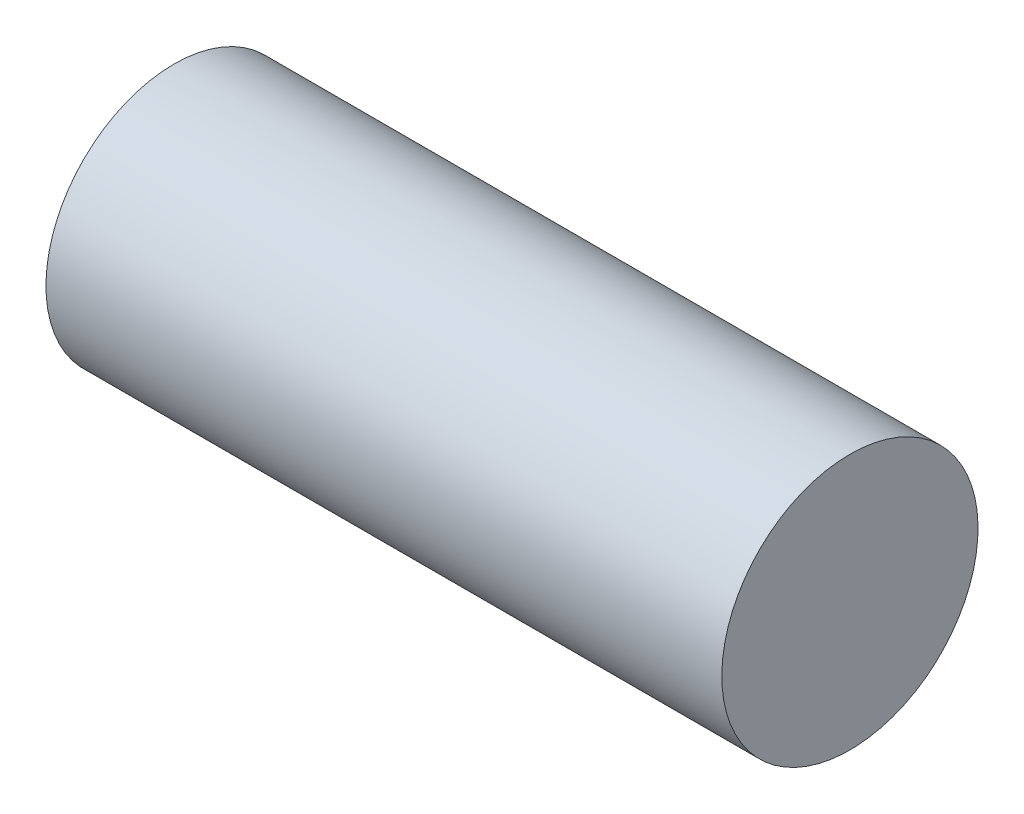
from build123d import *

# Parameters (mm, degrees)
CUT_EXTRUDE1_START  = -0.5
CUT_EXTRUDE1_DEPTH  = 2
CIRPATTERN1_COUNT   = 8
SKETCH3_R           = 0.75
SKETCH3_R_2         = 0.625
BOSS_EXTRUDE1_DEPTH = 2.5


with BuildPart() as part:
    # Sketch1 → Revolve1 (revolve)
    with BuildSketch(Plane.XY):
        Polygon((0, 0), (0, 1), (-1, 2), (-7, 2), (-7, 4), (-10, 4), (-10, 3), (-13, 3), (-14.5, 4.5), (-24.88, 4.5), (-24.88, 5), (1.5, 5), (1.5, 0), align=None)
    revolve(axis=Axis((1.5, 0, 0), (-1, 0, 0)))

    # Sketch2 → Cut-Extrude1 (cut)
    with BuildSketch(Plane.ZY.offset(7).offset(CUT_EXTRUDE1_START)):
        with BuildLine():
            Line((-2, -0.1), (-3.9, -0.1))
            ThreePointArc((-3.9, -0.1), (-4, 0), (-3.9, 0.1))
            Line((-3.9, 0.1), (-2, 0.1))
            ThreePointArc((-2, 0.1), (-1.9, 0), (-2, -0.1))
        make_face()
    cut_extrude1 = extrude(amount=CUT_EXTRUDE1_DEPTH, mode=Mode.SUBTRACT)

    # CirPattern1: Cut-Extrude1 ×8 about axis
    cirpattern1_axis = Axis((0, 0, 0), (1, 0, 0))
    for i in range(1, CIRPATTERN1_COUNT):
        add(cut_extrude1.rotate(cirpattern1_axis, i * 360 / CIRPATTERN1_COUNT), mode=Mode.SUBTRACT)

    # Sketch3 → Boss-Extrude1 (add)
    with BuildSketch(Plane.ZY):
        with Locations(Location((0, 0, 0), (0, 0, 270))):
            Circle(SKETCH3_R)
        with Locations(Location((0, 0, 0), (0, 0, 270))):
            Circle(SKETCH3_R_2, mode=Mode.SUBTRACT)
    extrude(amount=BOSS_EXTRUDE1_DEPTH)


solid = part.part
